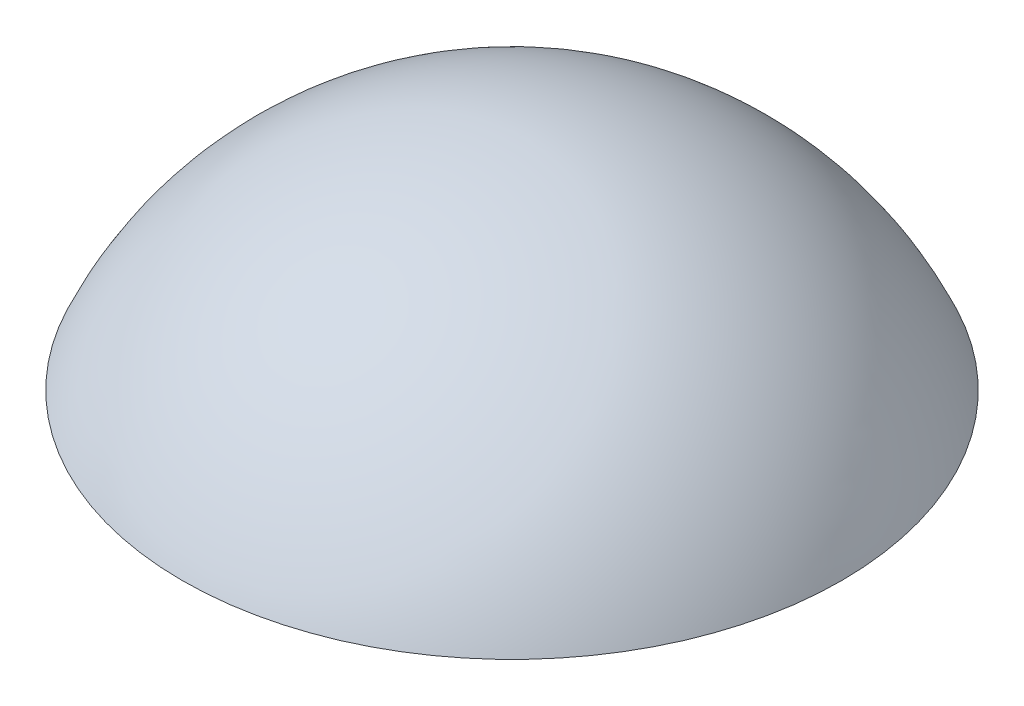
from build123d import *

# Parameters (mm, degrees)
SKETCH4_R           = 6.011753219
BOSS_EXTRUDE1_DEPTH = 56.896


with BuildPart() as part:
    # Sketch2 → Revolve2 (revolve)
    with BuildSketch(Plane.XY, mode=Mode.PRIVATE) as revolve2_sk:
        with BuildLine():
            Line((54.17268681, -17.357208877), (54.17268681, 45.126791123))
            ThreePointArc((54.17268681, 45.126791123), (10.456424572, 32.108239932), (-18.85231319, -2.84304259))
            Line((-18.85231319, -2.84304259), (2.700176409, -2.84304259))
            Line((2.700176409, -2.84304259), (11.392940607, -17.357208877))
            Line((11.392940607, -17.357208877), (54.17268681, -17.357208877))
        make_face()
    revolve(revolve2_sk.sketch.rotate(Axis((54.17268681, -17.357208877, 0), (0, 1, 0)), 270), axis=Axis((54.17268681, -17.357208877, 0), (0, 1, 0)))

    # Sketch4 → Boss-Extrude1 (add)
    with BuildSketch(Plane.XY):
        with Locations(Location((54.17268681, -10.121449935, 0), (0, 0, 228.566233485))):
            Circle(SKETCH4_R)
    extrude(amount=BOSS_EXTRUDE1_DEPTH)


solid = part.part
